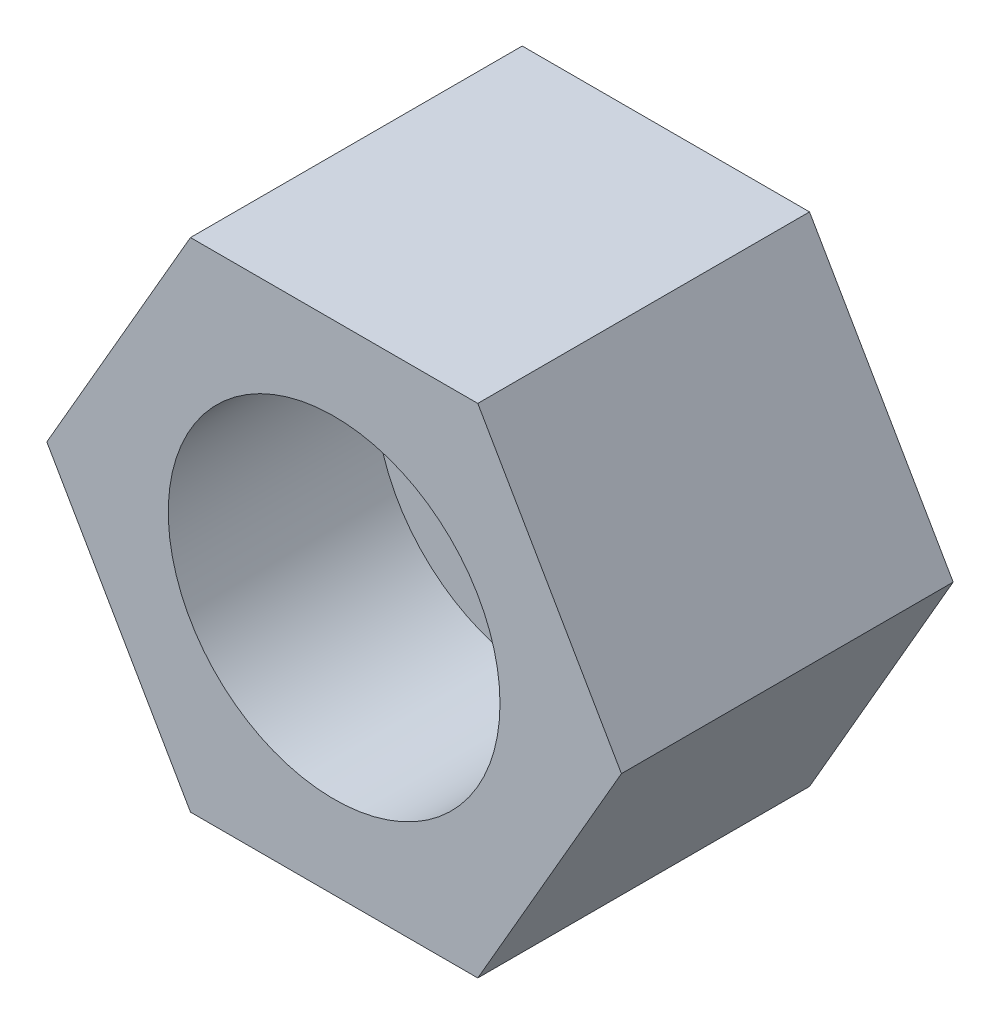
from build123d import *

# Parameters (mm, degrees)
SKETCH1_R           = 2
BOSS_EXTRUDE1_DEPTH = 4
SKETCH2_R           = 4
CUT_EXTRUDE1_DEPTH  = 5


with BuildPart() as part:
    # Sketch1 → Boss-Extrude1 (new, symmetric)
    with BuildSketch(Plane.XY):
        Polygon((6.92820323, 0), (3.464101615, 6), (-3.464101615, 6), (-6.92820323, 0), (-3.464101615, -6), (3.464101615, -6), align=None)
        Circle(SKETCH1_R, mode=Mode.SUBTRACT)
    extrude(amount=BOSS_EXTRUDE1_DEPTH, both=True)

    # Sketch2 → Cut-Extrude1 (cut)
    with BuildSketch(Plane.XY.offset(4)):
        Circle(SKETCH2_R)
    extrude(amount=-CUT_EXTRUDE1_DEPTH, mode=Mode.SUBTRACT)


solid = part.part
